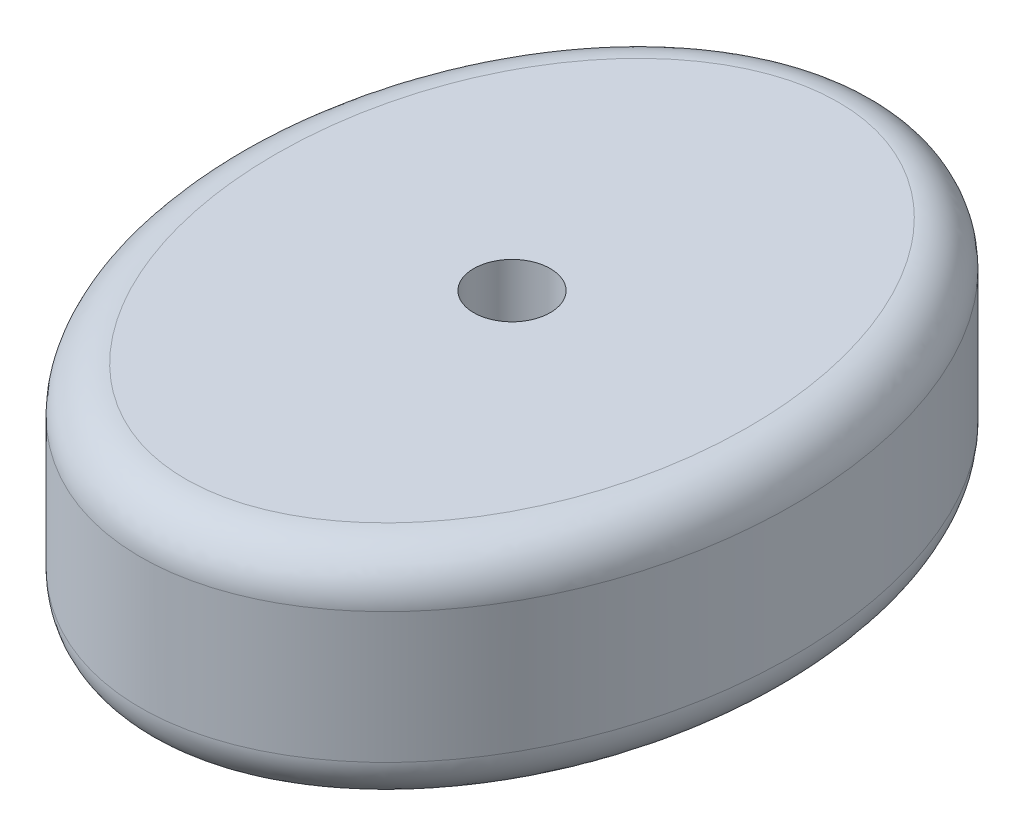
from build123d import *

# Parameters (mm, degrees)
SKETCH1_RX          = 8.25
SKETCH1_RY          = 6.25
SKETCH1_R           = 1.975
BOSS_EXTRUDE1_DEPTH = 2.4
SKETCH2_RX          = 8.25
SKETCH2_RY          = 6.25
SKETCH2_R           = 0.85
BOSS_EXTRUDE2_DEPTH = 2.5
FILLET1_R           = 1


with BuildPart() as part:
    # Sketch1 → Boss-Extrude1 (new body)
    with BuildSketch(Plane(origin=(0, 0, 0), x_dir=(1, 0, 0), z_dir=(0, 1, 0))):
        with Locations(Location((0, 0), (0, 0, 90))):
            Ellipse(SKETCH1_RX, SKETCH1_RY)
        with Locations(Location((0, 0, 0), (0, 0, 270))):
            Circle(SKETCH1_R, mode=Mode.SUBTRACT)
    extrude(amount=BOSS_EXTRUDE1_DEPTH)

    # Sketch2 → Boss-Extrude2 (add)
    with BuildSketch(Plane(origin=(0, 2.4, 0), x_dir=(1, 0, 0), z_dir=(0, 1, 0))):
        with Locations(Location((0, 0), (0, 0, 90))):
            Ellipse(SKETCH2_RX, SKETCH2_RY)
        with Locations(Location((0, 0, 0), (0, 0, 270))):
            Circle(SKETCH2_R, mode=Mode.SUBTRACT)
    extrude(amount=BOSS_EXTRUDE2_DEPTH)

    # Fillet1
    fillet1_edges = [part.edges().sort_by_distance(p)[0] for p in [
        (0.001952715, 4.9, 8.249999597),
        (0.001952715, 0, 8.249999597),
    ]]
    fillet(fillet1_edges, radius=FILLET1_R)


solid = part.part
